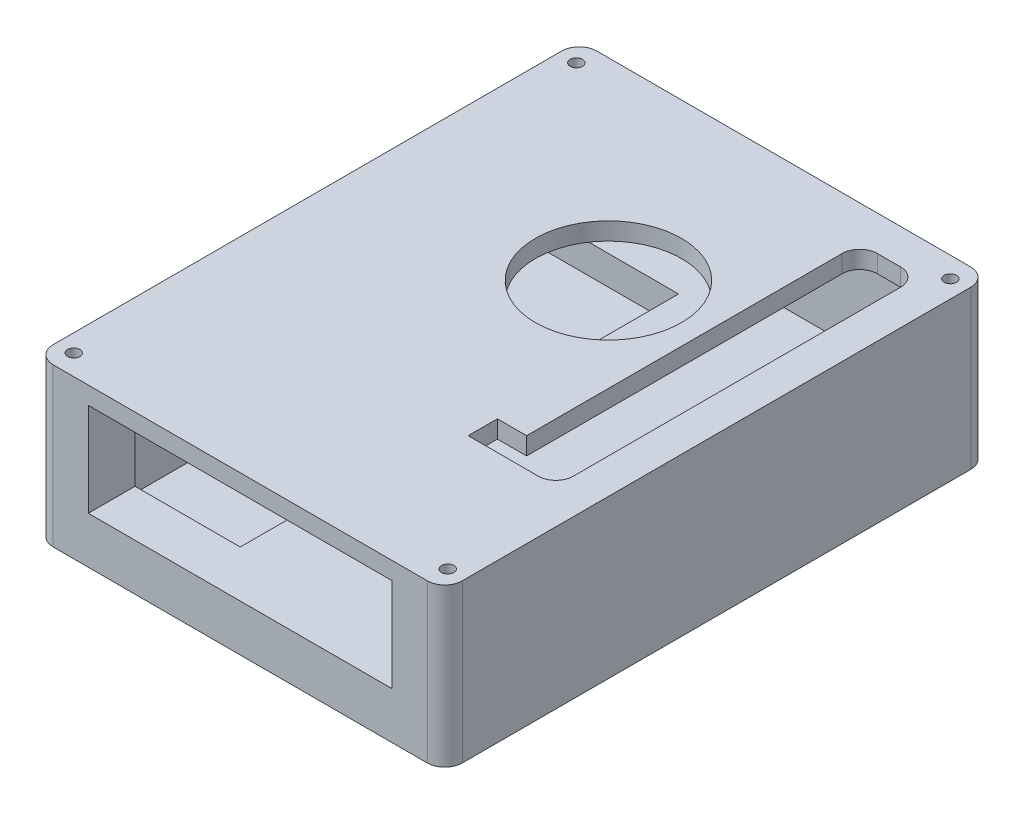
from build123d import *

# Parameters (mm, degrees)
EXTRUDE_1_DEPTH     = 27
SKETCH_2_W          = 55
SKETCH_2_H          = 14
CUT_EXTRUDE_1_DEPTH = 27
SKETCH_3_W          = 52
SKETCH_3_H          = 16
CUT_EXTRUDE_2_DEPTH = 90
CUT_EXTRUDE_START   = -19
SKETCH_4_R          = 12.5
CUT_EXTRUDE_3_DEPTH = 19
CUT_EXTRUDE_4_DEPTH = 20
SKETCH_6_R          = 1.05
CUT_EXTRUDE_5_DEPTH = 65.158008074


with BuildPart() as part:
    # 草图1 → 凸台-拉伸1 (new body)
    with BuildSketch(Plane(origin=(0, 0, 0), x_dir=(1, 0, 0), z_dir=(0, 1, 0))):
        with BuildLine():
            Line((-32, -46.5), (32, -46.5))
            ThreePointArc((32, -46.5), (34.121320344, -45.621320344), (35, -43.5))
            Line((35, -43.5), (35, 43.5))
            ThreePointArc((35, 43.5), (34.121320344, 45.621320344), (32, 46.5))
            Line((32, 46.5), (-32, 46.5))
            ThreePointArc((-32, 46.5), (-34.121320344, 45.621320344), (-35, 43.5))
            Line((-35, 43.5), (-35, -43.5))
            ThreePointArc((-35, -43.5), (-34.121320344, -45.621320344), (-32, -46.5))
        make_face()
    extrude(amount=EXTRUDE_1_DEPTH)

    # 草图2 → 切除-拉伸1 (cut)
    with BuildSketch(Plane.ZY.offset(35)):
        with Locations((-9, 10)):
            Rectangle(SKETCH_2_W, SKETCH_2_H)
    extrude(amount=-CUT_EXTRUDE_1_DEPTH, mode=Mode.SUBTRACT)

    # 草图3 → 切除-拉伸2 (cut)
    with BuildSketch(Plane.XY.offset(46.5)):
        with Locations((0, 16)):
            Rectangle(SKETCH_3_W, SKETCH_3_H)
    extrude(amount=-CUT_EXTRUDE_2_DEPTH, mode=Mode.SUBTRACT)

    # 草图4 → 切除-拉伸3 (cut)
    with BuildSketch(Plane(origin=(0, 27, 0), x_dir=(1, 0, 0), z_dir=(0, 1, 0)).offset(CUT_EXTRUDE_START)):
        with Locations(Location((3, 13.5, 0), (0, 0, 270))):
            Circle(SKETCH_4_R)
        with BuildLine():
            Line((26, 40.5), (22, 40.5))
            ThreePointArc((22, 40.5), (19.878679656, 39.621320344), (19, 37.5))
            Line((19, 37.5), (19, -16.5))
            Line((19, -16.5), (14, -16.5))
            Line((14, -16.5), (14, -21.5))
            Line((14, -21.5), (19, -21.5))
            Line((19, -21.5), (26, -21.5))
            ThreePointArc((26, -21.5), (28.121320344, -20.621320344), (29, -18.5))
            Line((29, -18.5), (29, 37.5))
            ThreePointArc((29, 37.5), (28.121320344, 39.621320344), (26, 40.5))
        make_face()
    extrude(amount=CUT_EXTRUDE_3_DEPTH, mode=Mode.SUBTRACT)

    # 草图5 → 切除-拉伸4 (cut)
    with BuildSketch(Plane(origin=(0, 0, 18.5), x_dir=(-1, 0, 0), z_dir=(0, 0, -1))):
        Polygon((26, 17), (30, 17), (30, 3), (8, 3), (8, 8), (26, 8), align=None)
    extrude(amount=-CUT_EXTRUDE_4_DEPTH, mode=Mode.SUBTRACT)

    # 草图6 → 切除-拉伸5 (cut, through all)
    with BuildSketch(Plane(origin=(0, 27, 0), x_dir=(1, 0, 0), z_dir=(0, 1, 0))):
        with Locations(Location((-32, 43, 0), (0, 0, 270))):
            Circle(SKETCH_6_R)
        with Locations(Location((-32, -43, 0), (0, 0, 270))):
            Circle(SKETCH_6_R)
        with Locations(Location((32, -43, 0), (0, 0, 270))):
            Circle(SKETCH_6_R)
        with Locations(Location((32, 43, 0), (0, 0, 270))):
            Circle(SKETCH_6_R)
    extrude(amount=-CUT_EXTRUDE_5_DEPTH, mode=Mode.SUBTRACT)


solid = part.part
